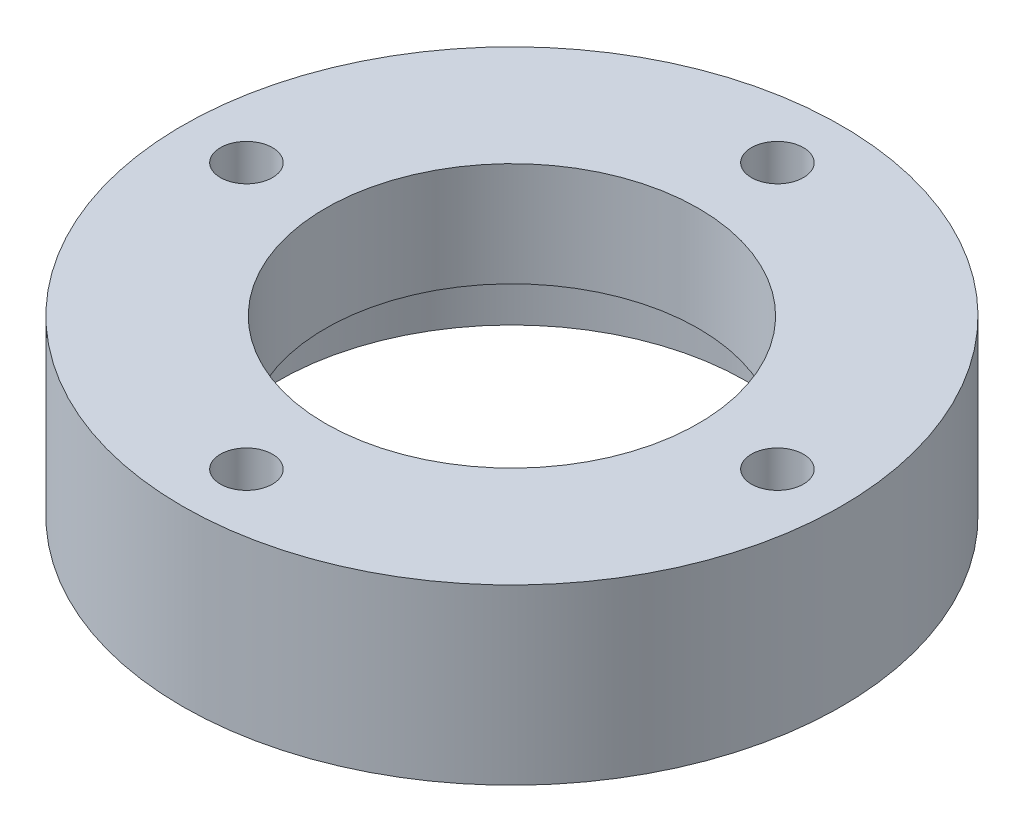
from build123d import *

# Parameters (mm, degrees)
SKETCH1_R          = 19
SKETCH1_R_2        = 10.75
EXTRUDE1_DEPTH     = 10
SKETCH2_R          = 13.5
CUT_EXTRUDE1_DEPTH = 4
SKETCH3_R          = 1.5
CUT_EXTRUDE2_DEPTH = 29.670542374


with BuildPart() as part:
    # Sketch1 → Extrude1 (new body)
    with BuildSketch(Plane(origin=(0, 0, 0), x_dir=(1, 0, 0), z_dir=(0, 1, 0))):
        with Locations(Location((0, 0, 0), (0, 0, 270))):
            Circle(SKETCH1_R)
        with Locations(Location((0, 0, 0), (0, 0, 270))):
            Circle(SKETCH1_R_2, mode=Mode.SUBTRACT)
    extrude(amount=EXTRUDE1_DEPTH)

    # Sketch2 → Cut-Extrude1 (cut)
    with BuildSketch(Plane.XZ):
        with Locations(Location((0, 0, 0), (0, 0, 270))):
            Circle(SKETCH2_R)
    extrude(amount=-CUT_EXTRUDE1_DEPTH, mode=Mode.SUBTRACT)

    # Sketch3 → Cut-Extrude2 (cut, through all)
    with BuildSketch(Plane(origin=(0, 10, 0), x_dir=(1, 0, 0), z_dir=(0, 1, 0))):
        with Locations(Location((0, 15.305022153, 0), (0, 0, 270))):
            Circle(SKETCH3_R)
        with Locations(Location((15.305022153, 0, 0), (0, 0, 270))):
            Circle(SKETCH3_R)
        with Locations(Location((0, -15.305022153, 0), (0, 0, 270))):
            Circle(SKETCH3_R)
        with Locations(Location((-15.305022153, 0, 0), (0, 0, 270))):
            Circle(SKETCH3_R)
    extrude(amount=-CUT_EXTRUDE2_DEPTH, mode=Mode.SUBTRACT)


solid = part.part
